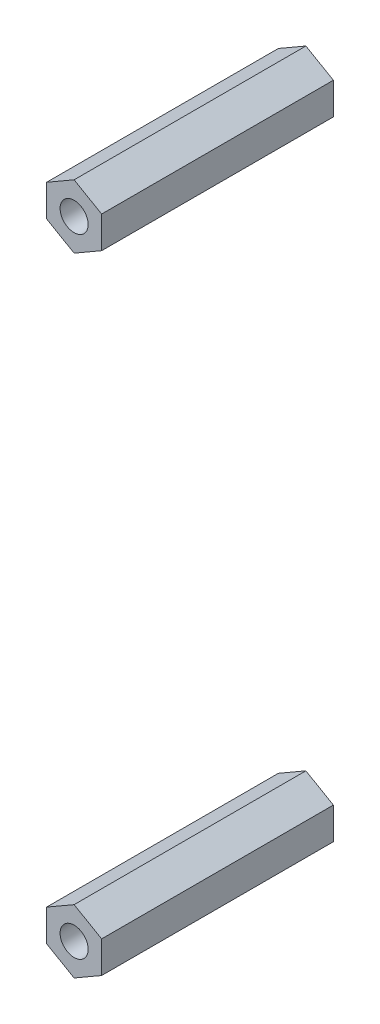
from build123d import *

# Parameters (mm, degrees)
SKETCH1_R             = 3.2639
BOSS_EXTRUDE1_DEPTH   = 53.9242
BOSS_EXTRUDE1_2_DEPTH = 53.9242


with BuildPart() as part:
    # Sketch1 → Boss-Extrude1 (new body)
    with BuildSketch(Plane.XY.offset(37.846)):
        Polygon((-33.4772, 104.254496397), (-33.4772, 111.645503603), (-39.878, 115.341007206), (-46.2788, 111.645503603), (-46.2788, 104.254496397), (-39.878, 100.558992794), align=None)
        with Locations((-39.878, 107.95)):
            Circle(SKETCH1_R, mode=Mode.SUBTRACT)
    extrude(amount=BOSS_EXTRUDE1_DEPTH)


with BuildPart() as body_2:
    # Sketch1 → Boss-Extrude1 2 (new body)
    with BuildSketch(Plane.XY.offset(37.846)):
        Polygon((-33.4772, -34.404496397), (-39.878, -30.708992794), (-46.2788, -34.404496397), (-46.2788, -41.795503603), (-39.878, -45.491007206), (-33.4772, -41.795503603), align=None)
        with Locations((-39.878, -38.1)):
            Circle(SKETCH1_R, mode=Mode.SUBTRACT)
    extrude(amount=BOSS_EXTRUDE1_2_DEPTH)


solid = Compound([part.part, body_2.part])
